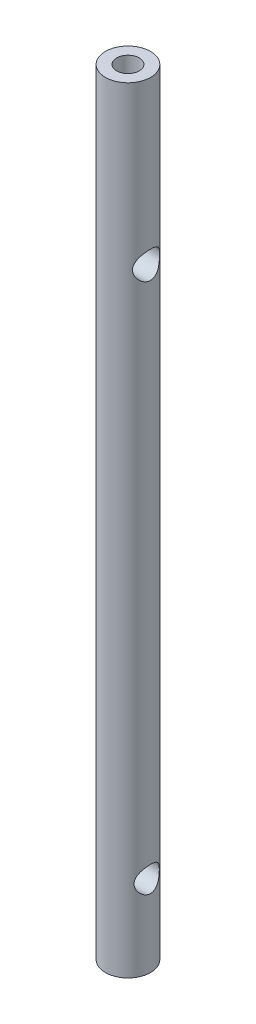
from build123d import *

# Parameters (mm, degrees)
SKETCH_1_R               = 2.5
EXTRUDE_1_DEPTH          = 86
HOLE_WIZARD_M3_1_D       = 2.5
HOLE_WIZARD_M3_1_DEPTH   = 6.748924226
HOLE_WIZARD_M3_1_TIP     = 0.751075774
HOLE_WIZARD_M3_2_D       = 2.5
HOLE_WIZARD_M3_2_DEPTH   = 6.748924226
HOLE_WIZARD_M3_2_TIP     = 0.751075774
CUT_EXTRUDE_2_DEPTH      = 5
CUT_EXTRUDE_2_DEPTH_BACK = 5
SKETCH_10_R              = 1.5
SKETCH_10_R_2            = 1.4


with BuildPart() as part:
    # 草图1 → 凸台-拉伸1 (new body)
    with BuildSketch(Plane(origin=(0, 0, 0), x_dir=(1, 0, 0), z_dir=(0, 1, 0))):
        Circle(SKETCH_1_R)
    extrude(amount=EXTRUDE_1_DEPTH)

    # M3 螺纹孔1
    with Locations(Plane(origin=(0, 0, 0), x_dir=(-1, 0, 0), z_dir=(0, -1, 0))):
        with Locations((0, 0)):
            Hole(HOLE_WIZARD_M3_1_D / 2, depth=HOLE_WIZARD_M3_1_DEPTH)
            with Locations((0, 0, -(HOLE_WIZARD_M3_1_DEPTH + HOLE_WIZARD_M3_1_TIP / 2))):  # 118° drill point
                Cone(0, HOLE_WIZARD_M3_1_D / 2, HOLE_WIZARD_M3_1_TIP, mode=Mode.SUBTRACT)

    # M3 螺纹孔2
    with Locations(Plane(origin=(0, 86, 0), x_dir=(1, 0, 0), z_dir=(0, 1, 0))):
        with Locations((0, 0)):
            Hole(HOLE_WIZARD_M3_2_D / 2, depth=HOLE_WIZARD_M3_2_DEPTH)
            with Locations((0, 0, -(HOLE_WIZARD_M3_2_DEPTH + HOLE_WIZARD_M3_2_TIP / 2))):  # 118° drill point
                Cone(0, HOLE_WIZARD_M3_2_D / 2, HOLE_WIZARD_M3_2_TIP, mode=Mode.SUBTRACT)

    # 草图10 → 切除-拉伸2 (cut, two sides: drawn at the far end of the back side and taken through both)
    with BuildSketch(Plane(origin=(0, 0, 0), x_dir=(0, 0, -1), z_dir=(1, 0, 0)).offset(-CUT_EXTRUDE_2_DEPTH_BACK)):
        with Locations((0, 68)):
            Circle(SKETCH_10_R)
        with Locations((0, 9)):
            Circle(SKETCH_10_R_2)
    extrude(amount=CUT_EXTRUDE_2_DEPTH + CUT_EXTRUDE_2_DEPTH_BACK, mode=Mode.SUBTRACT)


solid = part.part
